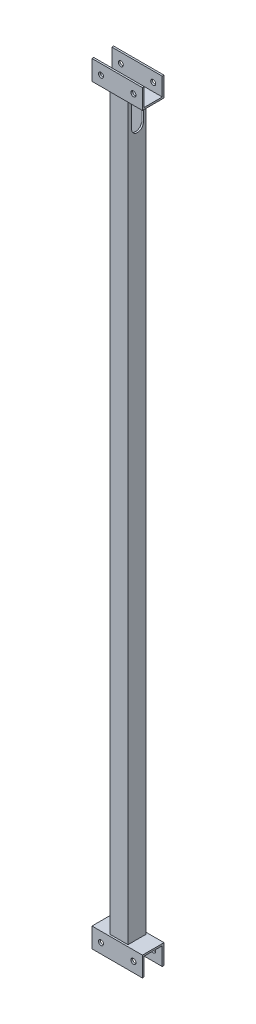
from build123d import *

# Parameters (mm, degrees)
SKETCH1_W               = 140
SKETCH1_H               = 60
BOSS_EXTRUDE1_DEPTH     = 5
SKETCH2_W               = 140
SKETCH2_H               = 5
BOSS_EXTRUDE3_DEPTH     = 50
SKETCH4_R               = 7
CUT_EXTRUDE1_DEPTH      = 108.354552768
SKETCH5_W               = 50
SKETCH5_H               = 50
SKETCH5_W_2             = 40
SKETCH5_H_2             = 40
BOSS_EXTRUDE4_DEPTH     = 1015
CUT_EXTRUDE3_DEPTH      = 2088.648198332
CUT_EXTRUDE3_DEPTH_BACK = 2088.648198332


with BuildPart() as part:
    # Sketch1 → Boss-Extrude1 (new body)
    with BuildSketch(Plane(origin=(0, 0, 0), x_dir=(1, 0, 0), z_dir=(0, 1, 0))):
        with Locations((0, 15)):
            Rectangle(SKETCH1_W, SKETCH1_H)
    extrude(amount=-BOSS_EXTRUDE1_DEPTH)

    # Sketch2 → Boss-Extrude3 (add)
    with BuildSketch(Plane.XZ.offset(5)):
        with Locations((0, 12.5)):
            Rectangle(SKETCH2_W, SKETCH2_H)
        with Locations((0, -42.5)):
            Rectangle(SKETCH2_W, SKETCH2_H)
    extrude(amount=BOSS_EXTRUDE3_DEPTH)

    # Sketch4 → Cut-Extrude1 (cut, through all)
    with BuildSketch(Plane.XY.offset(15)):
        with Locations((-45, -27.5)):
            Circle(SKETCH4_R)
        with Locations((45, -27.5)):
            Circle(SKETCH4_R)
    extrude(amount=-CUT_EXTRUDE1_DEPTH, mode=Mode.SUBTRACT)

    # Sketch5 → Boss-Extrude4 (add)
    with BuildSketch(Plane(origin=(0, 0, 0), x_dir=(1, 0, 0), z_dir=(0, 1, 0))):
        with Locations((0, 15)):
            Rectangle(SKETCH5_W, SKETCH5_H)
        with Locations((0, 15)):
            Rectangle(SKETCH5_W_2, SKETCH5_H_2, mode=Mode.SUBTRACT)
    extrude(amount=BOSS_EXTRUDE4_DEPTH)

    # Mirror1: part across plane


with BuildPart() as part_1:
    add(part.part)
    add(part.part.mirror(Plane.ZX.offset(1015)))

    # Sketch8 → Cut-Extrude3 (cut, two sides: drawn at the far end of the back side and taken through both)
    with BuildSketch(Plane.ZY.offset(25).offset(-CUT_EXTRUDE3_DEPTH_BACK)):
        with BuildLine():
            Line((-32.587539874, 2030), (-32.587539874, 1955.085156016))
            ThreePointArc((-32.587539874, 1955.085156016), (-16.293769937, 1938.791386079), (0, 1955.085156016))
            Line((0, 1955.085156016), (0, 2030))
            Line((0, 2030), (-32.587539874, 2030))
        make_face()
    extrude(amount=CUT_EXTRUDE3_DEPTH + CUT_EXTRUDE3_DEPTH_BACK, mode=Mode.SUBTRACT)


solid = part_1.part
